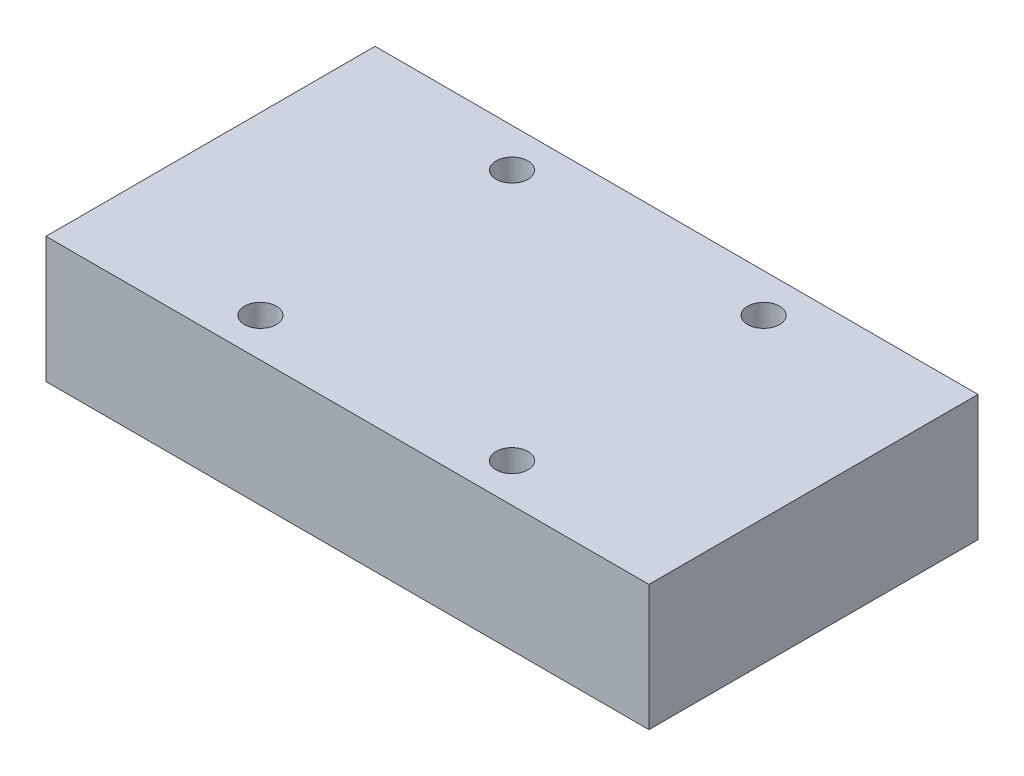
from build123d import *

# Parameters (mm, degrees)
SKETCH_1_W             = 62.3
SKETCH_1_H             = 34
EXTRUDE_303_DEPTH      = 13
HOLE_WIZARD_M4_1_D     = 3.3
HOLE_WIZARD_M4_1_DEPTH = 5
HOLE_WIZARD_M4_1_TIP   = 0.991420021


with BuildPart() as part:
    # 草图1 → Extrude 303 (new body)
    with BuildSketch(Plane(origin=(0, 0, 0), x_dir=(1, 0, 0), z_dir=(0, 1, 0))):
        Rectangle(SKETCH_1_W, SKETCH_1_H)
    extrude(amount=EXTRUDE_303_DEPTH)

    # M4 螺纹孔1
    with Locations(Plane(origin=(0, 13, 0), x_dir=(1, 0, 0), z_dir=(0, 1, 0))):
        with Locations((-13, 13), (-13, -13), (13, 13), (13, -13)):
            Hole(HOLE_WIZARD_M4_1_D / 2, depth=HOLE_WIZARD_M4_1_DEPTH)
            with Locations((0, 0, -(HOLE_WIZARD_M4_1_DEPTH + HOLE_WIZARD_M4_1_TIP / 2))):  # 118° drill point
                Cone(0, HOLE_WIZARD_M4_1_D / 2, HOLE_WIZARD_M4_1_TIP, mode=Mode.SUBTRACT)


solid = part.part
